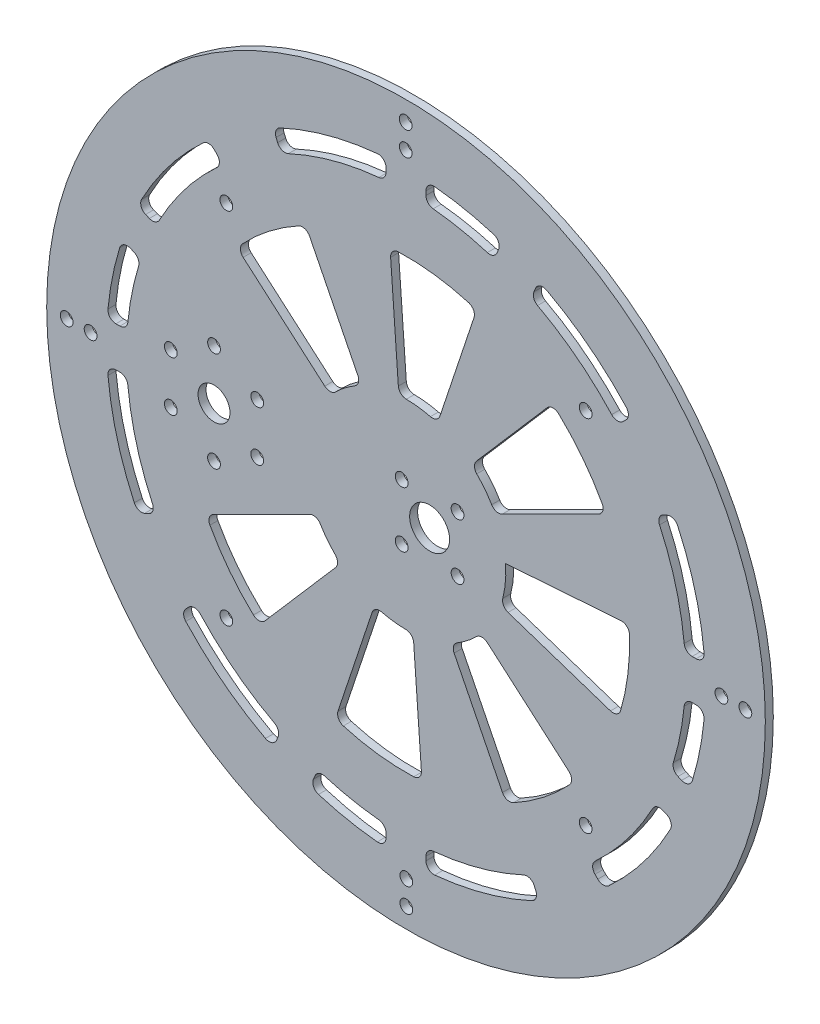
from build123d import *

# Parameters (mm, degrees)
SKETCH1_R           = 90
BOSS_EXTRUDE1_DEPTH = 2
SKETCH7_R           = 4
SKETCH7_R_2         = 1.6
SKETCH7_R_3         = 5
CUT_EXTRUDE4_DEPTH  = 2
SKETCH8_R           = 1.6
CUT_EXTRUDE5_DEPTH  = 2
SKETCH9_R           = 1.6
CUT_EXTRUDE6_DEPTH  = 2
SKETCH3_R           = 1.5
SKETCH3_R_2         = 3
SKETCH3_R_3         = 1.6
CUT_EXTRUDE2_DEPTH  = 2
SKETCH5_R           = 1.6
CUT_EXTRUDE3_DEPTH  = 2


with BuildPart() as part:
    # Sketch1 → Boss-Extrude1 (new body)
    with BuildSketch(Plane.XY):
        with Locations((-5.911688245, 0)):
            Circle(SKETCH1_R)
        with BuildLine():
            Line((59.561124922, 32.531688182), (58.636453379, 32.148676688))
            ThreePointArc((58.636453379, 32.148676688), (57.53851378, 31.027614961), (57.587556119, 29.459225467))
            ThreePointArc((57.587556119, 29.459225467), (61.628683594, 18.392883726), (63.756700666, 6.805555555))
            ThreePointArc((63.756700666, 6.805555555), (64.403516439, 5.518634263), (65.747226064, 5))
            Line((65.747226064, 5), (66.751920253, 5))
            ThreePointArc((66.751920253, 5), (68.232386673, 5.655299595), (68.742704047, 7.191780822))
            ThreePointArc((68.742704047, 7.191780822), (66.47177614, 19.637568169), (62.141236445, 31.524584709))
            ThreePointArc((62.141236445, 31.524584709), (61.053721317, 32.547027936), (59.561124922, 32.531688182))
        make_face(mode=Mode.SUBTRACT)
        with BuildLine():
            Line((2.589186323, 25.548681601), (11.12520061, 51.202972747))
            ThreePointArc((11.12520061, 51.202972747), (10.998971479, 52.762766603), (9.788202568, 53.754194519))
            ThreePointArc((9.788202568, 53.754194519), (1.06232298, 55.564045636), (-7.840167517, 55.966784504))
            ThreePointArc((-7.840167517, 55.966784504), (-9.258394715, 55.305329831), (-9.766184692, 53.825113628))
            Line((-9.766184692, 53.825113628), (-7.834961391, 26.857047872))
            ThreePointArc((-7.834961391, 26.857047872), (-7.2047805, 25.537863588), (-5.845375014, 24.999912051))
            ThreePointArc((-5.845375014, 24.999912051), (-2.798290377, 24.805377516), (0.202354477, 24.240843252))
            ThreePointArc((0.202354477, 24.240843252), (1.652538881, 24.426154675), (2.589186323, 25.548681601))
        make_face(mode=Mode.SUBTRACT)
        with BuildLine():
            Line((48.491320534, 47.331940967), (49.199033493, 48.039653927))
            ThreePointArc((49.199033493, 48.039653927), (49.78439749, 49.412762916), (49.255957141, 50.808767968))
            ThreePointArc((49.255957141, 50.808767968), (39.931011652, 59.358629247), (29.301649942, 66.219489681))
            ThreePointArc((29.301649942, 66.219489681), (27.68683638, 66.336003814), (26.514868525, 65.219003488))
            Line((26.514868525, 65.219003488), (26.130388705, 64.29078709))
            ThreePointArc((26.130388705, 64.29078709), (26.095328874, 62.85088853), (27.036763436, 61.760825219))
            ThreePointArc((27.036763436, 61.760825219), (36.927701892, 55.360515285), (45.605195993, 47.392094682))
            ThreePointArc((45.605195993, 47.392094682), (47.035431256, 46.746588793), (48.491320534, 47.331940967))
        make_face(mode=Mode.SUBTRACT)
        with BuildLine():
            Line((65.747226064, -5), (66.751920253, -5))
            ThreePointArc((66.751920253, -5), (68.232386673, -5.655299596), (68.742704047, -7.191780822))
            ThreePointArc((68.742704047, -7.191780822), (67.647207785, -14.631774152), (65.812152176, -21.92465998))
            ThreePointArc((65.812152176, -21.92465998), (64.752694489, -23.148893533), (63.134149566, -23.187761446))
            Line((63.134149566, -23.187761446), (62.205933169, -22.803281625))
            ThreePointArc((62.205933169, -22.803281625), (61.162980089, -21.809910633), (61.057883692, -20.373424711))
            ThreePointArc((61.057883692, -20.373424711), (62.743281383, -13.656322541), (63.756700666, -6.805555556))
            ThreePointArc((63.756700666, -6.805555556), (64.403516439, -5.518634264), (65.747226064, -5))
        make_face(mode=Mode.SUBTRACT)
        with BuildLine():
            Line((58.379098845, -32.04207695), (59.307315243, -32.426556771))
            ThreePointArc((59.307315243, -32.426556771), (60.424315569, -33.598524626), (60.307801436, -35.213338188))
            ThreePointArc((60.307801436, -35.213338188), (53.446941002, -45.842699898), (44.897079723, -55.167645387))
            ThreePointArc((44.897079723, -55.167645387), (43.501074671, -55.696085736), (42.127965682, -55.110721739))
            Line((42.127965682, -55.110721739), (41.420252722, -54.40300878))
            ThreePointArc((41.420252722, -54.40300878), (40.834900548, -52.947119502), (41.480406436, -51.516884239))
            ThreePointArc((41.480406436, -51.516884239), (49.44882704, -42.839390138), (55.849136974, -32.948451682))
            ThreePointArc((55.849136974, -32.948451682), (56.939200285, -32.00701712), (58.379098845, -32.04207695))
        make_face(mode=Mode.SUBTRACT)
        with BuildLine():
            Line((26.619999937, -65.472813167), (26.236988443, -64.548141625))
            ThreePointArc((26.236988443, -64.548141625), (25.115926716, -63.450202026), (23.547537222, -63.499244365))
            ThreePointArc((23.547537222, -63.499244365), (12.481195481, -67.54037184), (0.89386731, -69.668388912))
            ThreePointArc((0.89386731, -69.668388912), (-0.393053982, -70.315204685), (-0.911688245, -71.65891431))
            Line((-0.911688245, -71.65891431), (-0.911688245, -72.663608499))
            ThreePointArc((-0.911688245, -72.663608499), (-0.25638865, -74.144074919), (1.280092576, -74.654392293))
            ThreePointArc((1.280092576, -74.654392293), (13.725879924, -72.383464385), (25.612896464, -68.052924691))
            ThreePointArc((25.612896464, -68.052924691), (26.635339691, -66.965409562), (26.619999937, -65.472813167))
        make_face(mode=Mode.SUBTRACT)
        with BuildLine():
            Line((-10.911688245, -71.65891431), (-10.911688245, -72.663608499))
            ThreePointArc((-10.911688245, -72.663608499), (-11.566987841, -74.144074919), (-13.103469067, -74.654392293))
            ThreePointArc((-13.103469067, -74.654392293), (-20.543462397, -73.558896031), (-27.836348225, -71.723840421))
            ThreePointArc((-27.836348225, -71.723840421), (-29.060581778, -70.664382735), (-29.099449691, -69.045837812))
            Line((-29.099449691, -69.045837812), (-28.71496987, -68.117621415))
            ThreePointArc((-28.71496987, -68.117621415), (-27.721598878, -67.074668335), (-26.285112956, -66.969571938))
            ThreePointArc((-26.285112956, -66.969571938), (-19.568010787, -68.654969629), (-12.717243801, -69.668388912))
            ThreePointArc((-12.717243801, -69.668388912), (-11.430322509, -70.315204685), (-10.911688245, -71.65891431))
        make_face(mode=Mode.SUBTRACT)
        with BuildLine():
            Line((-37.953765195, -64.290787091), (-38.338245016, -65.219003489))
            ThreePointArc((-38.338245016, -65.219003489), (-39.510212871, -66.336003814), (-41.125026433, -66.219489682))
            ThreePointArc((-41.125026433, -66.219489682), (-51.754388143, -59.358629248), (-61.079333632, -50.808767969))
            ThreePointArc((-61.079333632, -50.808767969), (-61.607773981, -49.412762917), (-61.022409984, -48.039653927))
            Line((-61.022409984, -48.039653927), (-60.314697025, -47.331940968))
            ThreePointArc((-60.314697025, -47.331940968), (-58.858807747, -46.746588794), (-57.428572484, -47.392094682))
            ThreePointArc((-57.428572484, -47.392094682), (-48.751078383, -55.360515286), (-38.860139927, -61.76082522))
            ThreePointArc((-38.860139927, -61.76082522), (-37.918705365, -62.850888531), (-37.953765195, -64.290787091))
        make_face(mode=Mode.SUBTRACT)
        with BuildLine():
            Line((18.164983819, 12.054619957), (42.341180641, 24.159069606))
            ThreePointArc((42.341180641, 24.159069606), (43.35486398, 25.351267893), (43.199766475, 26.908456203))
            ThreePointArc((43.199766475, 26.908456203), (38.309395844, 34.358342829), (32.299163828, 40.938133614))
            ThreePointArc((32.299163828, 40.938133614), (30.828606675, 41.473252598), (29.422874024, 40.78564342))
            Line((29.422874024, 40.78564342), (11.719152944, 20.350760156))
            ThreePointArc((11.719152944, 20.350760156), (11.231953974, 18.972350822), (11.81280963, 17.630716805))
            ThreePointArc((11.81280963, 17.630716805), (13.829867151, 15.338545906), (15.55245747, 12.817583575))
            ThreePointArc((15.55245747, 12.817583575), (16.70892766, 11.923183313), (18.164983819, 12.054619957))
        make_face(mode=Mode.SUBTRACT)
        with BuildLine():
            Line((-71.384501413, -32.531688182), (-70.45982987, -32.148676689))
            ThreePointArc((-70.45982987, -32.148676689), (-69.361890271, -31.027614962), (-69.41093261, -29.459225467))
            ThreePointArc((-69.41093261, -29.459225467), (-73.452060085, -18.392883727), (-75.580077157, -6.805555556))
            ThreePointArc((-75.580077157, -6.805555556), (-76.22689293, -5.518634264), (-77.570602555, -5))
            Line((-77.570602555, -5), (-78.575296744, -5))
            ThreePointArc((-78.575296744, -5), (-80.055763164, -5.655299596), (-80.566080538, -7.191780822))
            ThreePointArc((-80.566080538, -7.191780822), (-78.295152631, -19.63756817), (-73.964612936, -31.52458471))
            ThreePointArc((-73.964612936, -31.52458471), (-72.877097808, -32.547027937), (-71.384501413, -32.531688182))
        make_face(mode=Mode.SUBTRACT)
        with BuildLine():
            Line((-77.570602555, 5), (-78.575296744, 5))
            ThreePointArc((-78.575296744, 5), (-80.055763164, 5.655299595), (-80.566080538, 7.191780822))
            ThreePointArc((-80.566080538, 7.191780822), (-79.470584276, 14.631774151), (-77.635528667, 21.92465998))
            ThreePointArc((-77.635528667, 21.92465998), (-76.57607098, 23.148893533), (-74.957526057, 23.187761445))
            Line((-74.957526057, 23.187761445), (-74.02930966, 22.803281625))
            ThreePointArc((-74.02930966, 22.803281625), (-72.98635658, 21.809910632), (-72.881260183, 20.373424711))
            ThreePointArc((-72.881260183, 20.373424711), (-74.566657874, 13.656322541), (-75.580077157, 6.805555555))
            ThreePointArc((-75.580077157, 6.805555555), (-76.22689293, 5.518634263), (-77.570602555, 5))
        make_face(mode=Mode.SUBTRACT)
        with BuildLine():
            Line((-70.202475336, 32.04207695), (-71.130691734, 32.42655677))
            ThreePointArc((-71.130691734, 32.42655677), (-72.24769206, 33.598524626), (-72.131177927, 35.213338187))
            ThreePointArc((-72.131177927, 35.213338187), (-65.270317493, 45.842699897), (-56.720456214, 55.167645386))
            ThreePointArc((-56.720456214, 55.167645386), (-55.324451162, 55.696085735), (-53.951342172, 55.110721739))
            Line((-53.951342172, 55.110721739), (-53.243629213, 54.403008779))
            ThreePointArc((-53.243629213, 54.403008779), (-52.658277039, 52.947119501), (-53.303782927, 51.516884238))
            ThreePointArc((-53.303782927, 51.516884238), (-61.272203531, 42.839390137), (-67.672513465, 32.948451681))
            ThreePointArc((-67.672513465, 32.948451681), (-68.762576776, 32.00701712), (-70.202475336, 32.04207695))
        make_face(mode=Mode.SUBTRACT)
        with BuildLine():
            Line((-38.443376427, 65.472813167), (-38.060364934, 64.548141624))
            ThreePointArc((-38.060364934, 64.548141624), (-36.939303207, 63.450202025), (-35.370913713, 63.499244364))
            ThreePointArc((-35.370913713, 63.499244364), (-24.304571972, 67.540371839), (-12.717243801, 69.668388912))
            ThreePointArc((-12.717243801, 69.668388912), (-11.430322509, 70.315204684), (-10.911688245, 71.658914309))
            Line((-10.911688245, 71.658914309), (-10.911688245, 72.663608498))
            ThreePointArc((-10.911688245, 72.663608498), (-11.566987841, 74.144074918), (-13.103469067, 74.654392292))
            ThreePointArc((-13.103469067, 74.654392292), (-25.549256415, 72.383464385), (-37.436272955, 68.05292469))
            ThreePointArc((-37.436272955, 68.05292469), (-38.458716182, 66.965409562), (-38.443376427, 65.472813167))
        make_face(mode=Mode.SUBTRACT)
        with BuildLine():
            Line((-0.911688245, 71.658914309), (-0.911688245, 72.663608498))
            ThreePointArc((-0.911688245, 72.663608498), (-0.25638865, 74.144074918), (1.280092576, 74.654392292))
            ThreePointArc((1.280092576, 74.654392292), (8.720085906, 73.55889603), (16.012971735, 71.723840421))
            ThreePointArc((16.012971735, 71.723840421), (17.237205288, 70.664382734), (17.2760732, 69.045837812))
            Line((17.2760732, 69.045837812), (16.891593379, 68.117621414))
            ThreePointArc((16.891593379, 68.117621414), (15.898222387, 67.074668334), (14.461736466, 66.969571938))
            ThreePointArc((14.461736466, 66.969571938), (7.744634296, 68.654969628), (0.89386731, 69.668388912))
            ThreePointArc((0.89386731, 69.668388912), (-0.393053982, 70.315204684), (-0.911688245, 71.658914309))
        make_face(mode=Mode.SUBTRACT)
        with BuildLine():
            Line((19.636993356, -8.500874569), (45.291284501, -17.036888856))
            ThreePointArc((45.291284501, -17.036888856), (46.851078358, -16.910659725), (47.842506274, -15.699890814))
            ThreePointArc((47.842506274, -15.699890814), (49.65235739, -6.974011226), (50.055096258, 1.928479271))
            ThreePointArc((50.055096258, 1.928479271), (49.393641586, 3.346706469), (47.913425383, 3.854496446))
            Line((47.913425383, 3.854496446), (19.02445469, 1.785714285))
            ThreePointArc((19.02445469, 1.785714285), (18.992037035, -2.191909482), (18.329155007, -6.114042723))
            ThreePointArc((18.329155007, -6.114042723), (18.51446643, -7.564227127), (19.636993356, -8.500874569))
        make_face(mode=Mode.SUBTRACT)
        with BuildLine():
            Line((6.142931712, -24.076672064), (18.247381361, -48.252868887))
            ThreePointArc((18.247381361, -48.252868887), (19.439579648, -49.266552225), (20.996767958, -49.111454721))
            ThreePointArc((20.996767958, -49.111454721), (28.446654584, -44.221084089), (35.026445369, -38.210852074))
            ThreePointArc((35.026445369, -38.210852074), (35.561564353, -36.740294921), (34.873955175, -35.33456227))
            Line((34.873955175, -35.33456227), (14.439071911, -17.63084119))
            ThreePointArc((14.439071911, -17.63084119), (13.060662577, -17.143642219), (11.71902856, -17.724497876))
            ThreePointArc((11.71902856, -17.724497876), (9.426857661, -19.741555397), (6.90589533, -21.464145715))
            ThreePointArc((6.90589533, -21.464145715), (6.011495068, -22.620615905), (6.142931712, -24.076672064))
        make_face(mode=Mode.SUBTRACT)
        with BuildLine():
            Line((-14.412562814, -25.548681602), (-22.948577101, -51.202972747))
            ThreePointArc((-22.948577101, -51.202972747), (-22.82234797, -52.762766604), (-21.611579059, -53.75419452))
            ThreePointArc((-21.611579059, -53.75419452), (-12.885699471, -55.564045636), (-3.983208974, -55.966784504))
            ThreePointArc((-3.983208974, -55.966784504), (-2.564981776, -55.305329832), (-2.057191799, -53.825113629))
            Line((-2.057191799, -53.825113629), (-3.9884151, -26.857047872))
            ThreePointArc((-3.9884151, -26.857047872), (-4.618595991, -25.537863589), (-5.978001476, -24.999912051))
            ThreePointArc((-5.978001476, -24.999912051), (-9.025086114, -24.805377516), (-12.025730968, -24.240843253))
            ThreePointArc((-12.025730968, -24.240843253), (-13.475915372, -24.426154676), (-14.412562814, -25.548681602))
        make_face(mode=Mode.SUBTRACT)
        with BuildLine():
            Line((-29.98836031, -12.054619958), (-54.164557132, -24.159069606))
            ThreePointArc((-54.164557132, -24.159069606), (-55.17824047, -25.351267894), (-55.023142966, -26.908456204))
            ThreePointArc((-55.023142966, -26.908456204), (-50.132772335, -34.35834283), (-44.122540319, -40.938133614))
            ThreePointArc((-44.122540319, -40.938133614), (-42.651983166, -41.473252599), (-41.246250515, -40.785643421))
            Line((-41.246250515, -40.785643421), (-23.542529435, -20.350760157))
            ThreePointArc((-23.542529435, -20.350760157), (-23.055330464, -18.972350822), (-23.636186121, -17.630716805))
            ThreePointArc((-23.636186121, -17.630716805), (-25.653243642, -15.338545906), (-27.375833961, -12.817583576))
            ThreePointArc((-27.375833961, -12.817583576), (-28.532304151, -11.923183314), (-29.98836031, -12.054619958))
        make_face(mode=Mode.SUBTRACT)
        with BuildLine():
            Line((-17.966308203, 24.076672064), (-30.070757851, 48.252868886))
            ThreePointArc((-30.070757851, 48.252868886), (-31.262956139, 49.266552225), (-32.820144449, 49.11145472))
            ThreePointArc((-32.820144449, 49.11145472), (-40.270031075, 44.221084089), (-46.84982186, 38.210852073))
            ThreePointArc((-46.84982186, 38.210852073), (-47.384940844, 36.74029492), (-46.697331666, 35.334562269))
            Line((-46.697331666, 35.334562269), (-26.262448402, 17.63084119))
            ThreePointArc((-26.262448402, 17.63084119), (-24.884039068, 17.143642219), (-23.54240505, 17.724497875))
            ThreePointArc((-23.54240505, 17.724497875), (-21.250234151, 19.741555397), (-18.729271821, 21.464145715))
            ThreePointArc((-18.729271821, 21.464145715), (-17.834871559, 22.620615905), (-17.966308203, 24.076672064))
        make_face(mode=Mode.SUBTRACT)
    extrude(amount=BOSS_EXTRUDE1_DEPTH)

    # Sketch7 → Cut-Extrude4 (cut)
    with BuildSketch(Plane(origin=(0, 0, 0), x_dir=(-1, 0, 0), z_dir=(0, 0, -1))):
        with Locations((54, 0)):
            Circle(SKETCH7_R)
        with Locations((54, -12.5)):
            Circle(SKETCH7_R_2)
        with Locations((43.174682453, -6.25)):
            Circle(SKETCH7_R_2)
        with Locations((43.174682453, 6.25)):
            Circle(SKETCH7_R_2)
        with Locations((54, 12.5)):
            Circle(SKETCH7_R_2)
        with Locations((64.825317547, 6.25)):
            Circle(SKETCH7_R_2)
        with Locations((64.825317547, -6.25)):
            Circle(SKETCH7_R_2)
        Circle(SKETCH7_R_3)
        with Locations((-7, 7)):
            Circle(SKETCH7_R_2)
        with Locations((7, 7)):
            Circle(SKETCH7_R_2)
        with Locations((7, -7)):
            Circle(SKETCH7_R_2)
        with Locations((-7, -7)):
            Circle(SKETCH7_R_2)
    extrude(amount=-CUT_EXTRUDE4_DEPTH, mode=Mode.SUBTRACT)

    # Sketch8 → Cut-Extrude5 (cut)
    with BuildSketch(Plane.XY.offset(2)):
        with Locations((-50.911688245, 45)):
            Circle(SKETCH8_R)
        with Locations((39.088311755, 45)):
            Circle(SKETCH8_R)
        with Locations((39.088311755, -45)):
            Circle(SKETCH8_R)
        with Locations((-50.911688245, -45)):
            Circle(SKETCH8_R)
    extrude(amount=-CUT_EXTRUDE5_DEPTH, mode=Mode.SUBTRACT)

    # Sketch9 → Cut-Extrude6 (cut)
    with BuildSketch(Plane(origin=(0, 0, 0), x_dir=(-1, 0, 0), z_dir=(0, 0, -1))):
        with Locations((5.830538551, -84.999999997)):
            Circle(SKETCH9_R)
        with Locations((5.830538551, -78.999999997)):
            Circle(SKETCH9_R)
        with Locations((-79.088311751, 0.081149694)):
            Circle(SKETCH9_R)
        with Locations((-73.088311751, 0.081149694)):
            Circle(SKETCH9_R)
        with Locations((5.99283794, 84.999999996)):
            Circle(SKETCH9_R)
        with Locations((5.99283794, 78.999999996)):
            Circle(SKETCH9_R)
        with Locations((90.911688242, -0.081149695)):
            Circle(SKETCH9_R)
        with Locations((84.911688242, -0.081149695)):
            Circle(SKETCH9_R)
    extrude(amount=-CUT_EXTRUDE6_DEPTH, mode=Mode.SUBTRACT)

    # Sketch3 → Cut-Extrude2 (cut)
    with BuildSketch(Plane(origin=(0, 0, 0), x_dir=(-1, 0, 0), z_dir=(0, 0, -1))):
        with Locations((-7, 7)):
            Circle(SKETCH3_R)
        with Locations((7, 7)):
            Circle(SKETCH3_R)
        with Locations((7, -7)):
            Circle(SKETCH3_R)
        with Locations((-7, -7)):
            Circle(SKETCH3_R)
        with Locations((54, 0)):
            Circle(SKETCH3_R_2)
        with Locations((54, 12.5)):
            Circle(SKETCH3_R_3)
        with Locations((64.825317547, 6.25)):
            Circle(SKETCH3_R_3)
        with Locations((64.825317547, -6.25)):
            Circle(SKETCH3_R_3)
        with Locations((54, -12.5)):
            Circle(SKETCH3_R_3)
        with Locations((43.174682453, -6.25)):
            Circle(SKETCH3_R_3)
        with Locations((43.174682453, 6.25)):
            Circle(SKETCH3_R_3)
    extrude(amount=-CUT_EXTRUDE2_DEPTH, mode=Mode.SUBTRACT)

    # Sketch5 → Cut-Extrude3 (cut)
    with BuildSketch(Plane.XY.offset(2)):
        with Locations((-50.911688245, 45)):
            Circle(SKETCH5_R)
        with Locations((39.088311755, 45)):
            Circle(SKETCH5_R)
        with Locations((39.088311755, -45)):
            Circle(SKETCH5_R)
        with Locations((-50.911688245, -45)):
            Circle(SKETCH5_R)
    extrude(amount=-CUT_EXTRUDE3_DEPTH, mode=Mode.SUBTRACT)


solid = part.part
